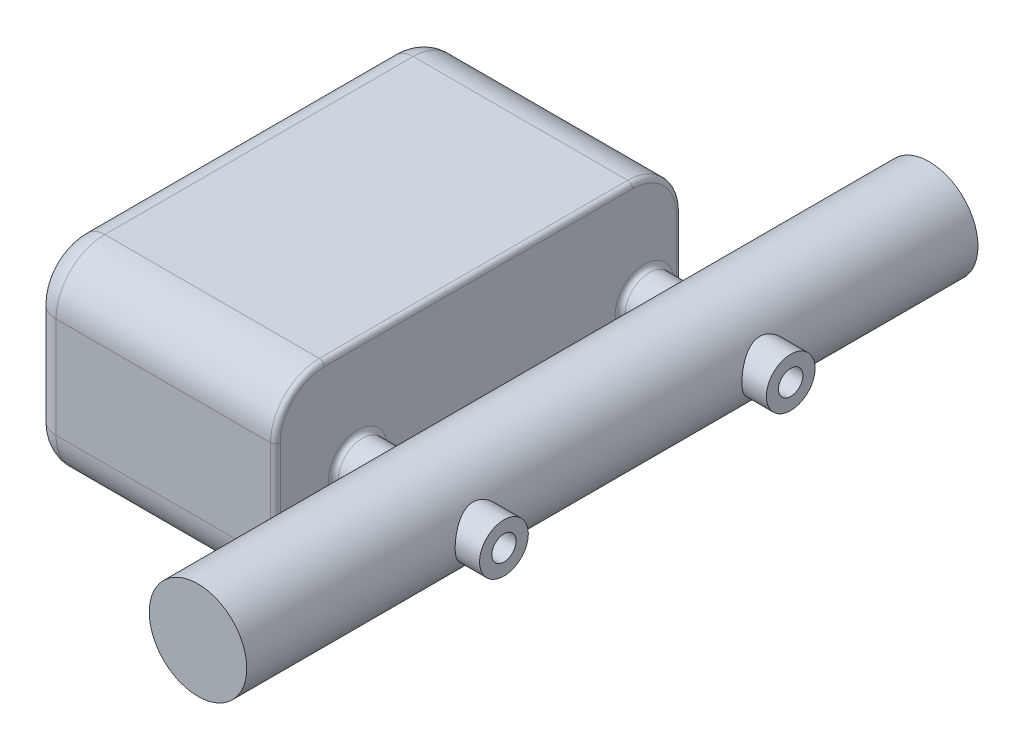
from build123d import *

# Parameters (mm, degrees)
SZKIC1_R                    = 20
DODANIE_WYCI_GNI_CIE1_DEPTH = 300
SZKIC2_R                    = 10
SZKIC2_R_2                  = 5
DODANIE_WYCI_GNI_CIE2_DEPTH = 30
DODANIE_WYCI_GNI_CIE3_DEPTH = 100
ZAOKR_GLENIE1_R             = 10
ZAOKR_GLENIE2_R             = 2


with BuildPart() as part:
    # Szkic1 → Dodanie-wyciągnięcie1 (new body)
    with BuildSketch(Plane.XY):
        Circle(SZKIC1_R)
    extrude(amount=DODANIE_WYCI_GNI_CIE1_DEPTH)

    # Szkic2 → Dodanie-wyciągnięcie2 (add)
    # profile 1 of 2: a face of its own
    with BuildSketch(Plane(origin=(0, 0, 0), x_dir=(0, 0, -1), z_dir=(1, 0, 0))):
        with Locations((-204.481584116, 0)):
            Circle(SZKIC2_R)
        with Locations(Location((-204.481584116, 0, 0), (0, 0, 180))):
            Circle(SZKIC2_R_2, mode=Mode.SUBTRACT)
    # profile 2 of 2: a face of its own
    with BuildSketch(Plane(origin=(0, 0, 0), x_dir=(0, 0, -1), z_dir=(1, 0, 0))):
        with Locations((-86.839933458, 0)):
            Circle(SZKIC2_R)
        with Locations(Location((-86.839933458, 0, 0), (0, 0, 180))):
            Circle(SZKIC2_R_2, mode=Mode.SUBTRACT)
    dodanie_wyci_gni_cie2 = extrude(amount=DODANIE_WYCI_GNI_CIE2_DEPTH)

    # Lustro1: Dodanie-wyciągnięcie2 across plane
    add(dodanie_wyci_gni_cie2.mirror(Plane(origin=(0, 0, 0), x_dir=(0, 0, 1), z_dir=(1, 0, 0))))

    # Szkic3 → Dodanie-wyciągnięcie3 (add)
    with BuildSketch(Plane.ZY.offset(30)):
        with BuildLine():
            Line((91.732945532, -38.08889509), (218.231237994, -38.08889509))
            ThreePointArc((218.231237994, -38.08889509), (232.373373618, -32.231030714), (238.231237994, -18.08889509))
            Line((238.231237994, -18.08889509), (238.231237994, 23.231699491))
            ThreePointArc((238.231237994, 23.231699491), (232.373373618, 37.373835114), (218.231237994, 43.231699491))
            Line((218.231237994, 43.231699491), (91.732945532, 43.231699491))
            ThreePointArc((91.732945532, 43.231699491), (77.590809908, 37.373835114), (71.732945532, 23.231699491))
            Line((71.732945532, 23.231699491), (71.732945532, -18.08889509))
            ThreePointArc((71.732945532, -18.08889509), (77.590809908, -32.231030714), (91.732945532, -38.08889509))
        make_face()
    extrude(amount=DODANIE_WYCI_GNI_CIE3_DEPTH)

    # Zaokrąglenie1
    zaokr_glenie1_edges = [part.edges().sort_by_distance(p)[0] for p in [
        (-130, -32.231030714, 77.590809908),
        (-130, -38.08889509, 154.982091763),
        (-130, -32.231030714, 232.373373618),
        (-130, 2.5714022, 238.231237994),
        (-130, 37.373835114, 232.373373618),
        (-130, 43.231699491, 154.982091763),
        (-130, 37.373835114, 77.590809908),
        (-130, 2.5714022, 71.732945532),
    ]]
    fillet(zaokr_glenie1_edges, radius=ZAOKR_GLENIE1_R)

    # Zaokrąglenie2
    zaokr_glenie2_edges = [part.edges().sort_by_distance(p)[0] for p in [
        (-30, 0, 214.481584116),
        (-30, 0, 96.839933458),
        (-30, -32.231030714, 77.590809908),
        (-30, -38.08889509, 154.982091763),
        (-30, -32.231030714, 232.373373618),
        (-30, 2.5714022, 238.231237994),
        (-30, 37.373835114, 232.373373618),
        (-30, 43.231699491, 154.982091763),
        (-30, 37.373835114, 77.590809908),
        (-30, 2.5714022, 71.732945532),
    ]]
    fillet(zaokr_glenie2_edges, radius=ZAOKR_GLENIE2_R)


solid = part.part
